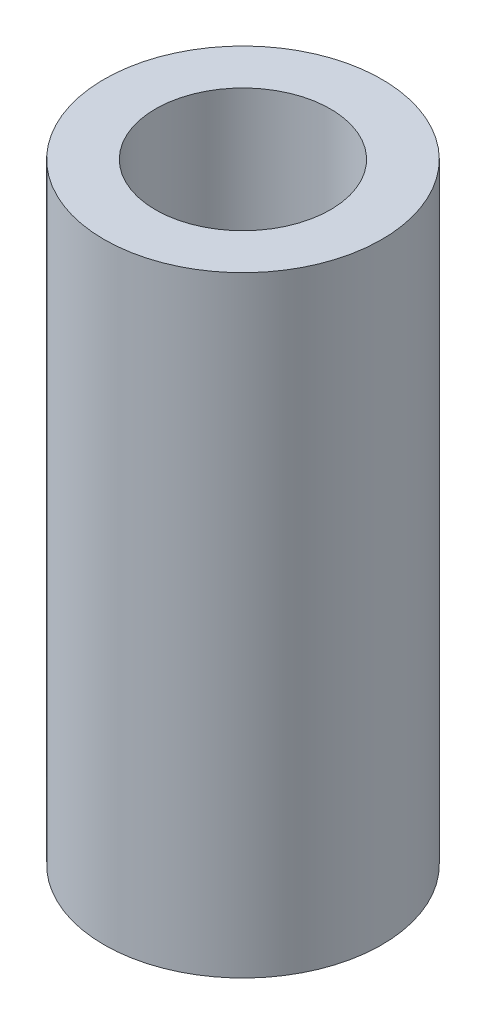
from build123d import *

# Parameters (mm, degrees)
SKETCH1_R           = 3.175
SKETCH1_R_2         = 1.999996
BOSS_EXTRUDE1_DEPTH = 13.97


with BuildPart() as part:
    # Sketch1 → Boss-Extrude1 (new body)
    with BuildSketch(Plane(origin=(0, 0, 0), x_dir=(1, 0, 0), z_dir=(0, 1, 0))):
        with Locations(Location((0, 0, 0), (0, 0, 270))):
            Circle(SKETCH1_R)
        with Locations(Location((0, 0, 0), (0, 0, 270))):
            Circle(SKETCH1_R_2, mode=Mode.SUBTRACT)
    extrude(amount=-BOSS_EXTRUDE1_DEPTH)


solid = part.part
